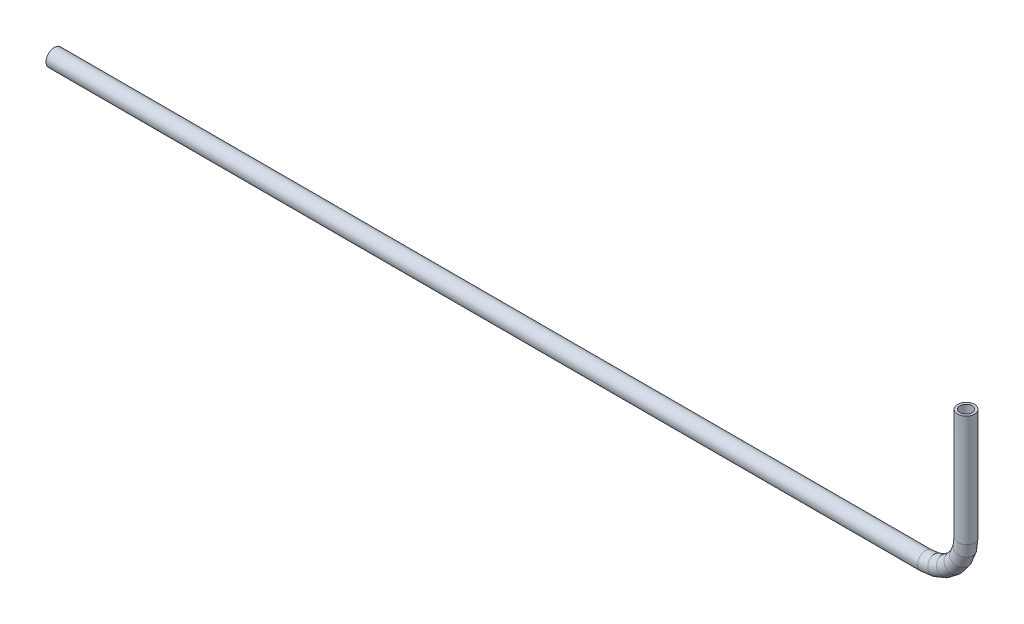
from build123d import *

# Parameters (mm, degrees)
PROFILE_R   = 3.175
PROFILE_R_2 = 2.286


with BuildPart() as part:
    # Tube: sweep along a curve in space
    with BuildLine() as tube_path:
        Line((-3351.142778381, -88, 0), (-3023.592778381, -88, 0))
        Line((-3023.592778381, -88, 0), (-3019.710492704, -87.488887394, 0))
        Line((-3019.710492704, -87.488887394, 0), (-3016.092778381, -85.990381057, 0))
        Line((-3016.092778381, -85.990381057, 0), (-3012.986176663, -83.606601718, 0))
        Line((-3012.986176663, -83.606601718, 0), (-3010.602397324, -80.5, 0))
        Line((-3010.602397324, -80.5, 0), (-3009.103890986, -76.882285677, 0))
        Line((-3009.103890986, -76.882285677, 0), (-3008.592778381, -73, 0))
        Line((-3008.592778381, -73, 0), (-3008.592778381, -31.3, 0))
    # Profile → Tube (sweep)
    with BuildSketch(Plane(origin=(-3351.142778381, 0, 0), x_dir=(0, 0, -1), z_dir=(1, 0, 0))):
        with Locations((0, -88)):
            Circle(PROFILE_R)
        with Locations((0, -88)):
            Circle(PROFILE_R_2, mode=Mode.SUBTRACT)
    sweep(path=tube_path.line, transition=Transition.RIGHT)


solid = part.part
